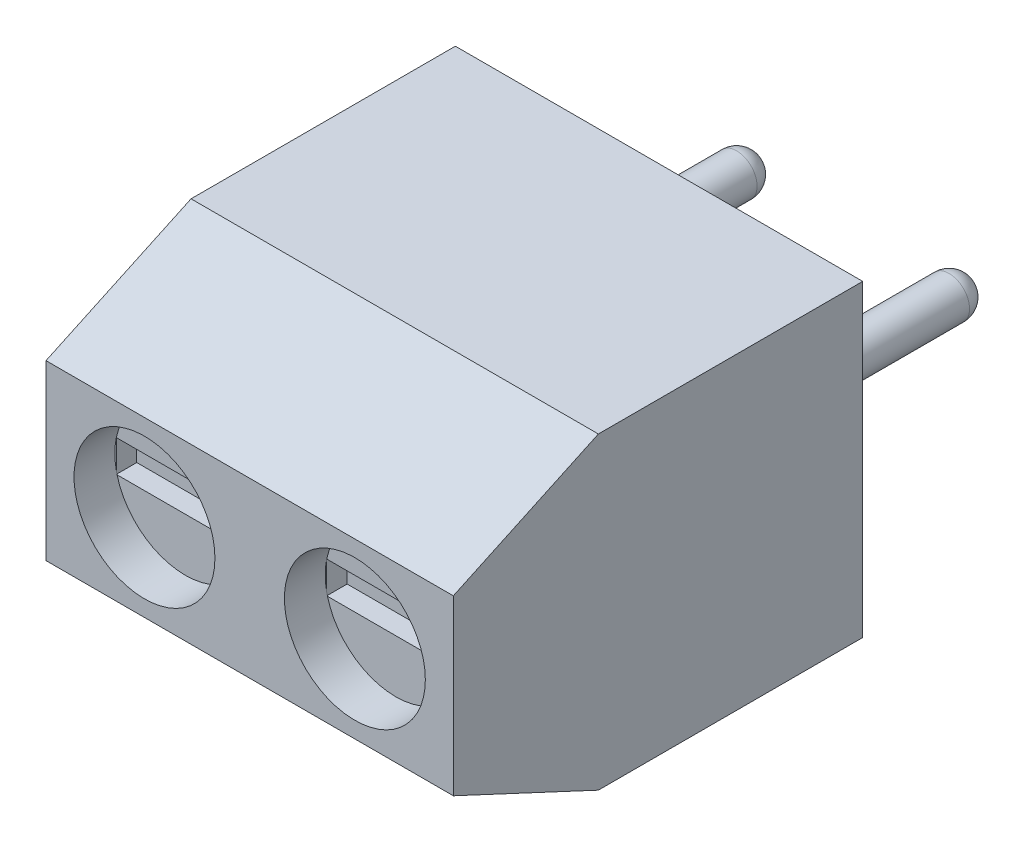
from build123d import *
from OCP.BRepFilletAPI import BRepFilletAPI_MakeChamfer

# Parameters (mm, degrees)
ESQUISSE1_W             = 9.97
ESQUISSE1_H             = 7.55
EXTRUSION1_DEPTH        = 10.02
CHANFREIN1_SIZE         = 3.55
CHANFREIN1_SIZE2        = 1.655392186
ESQUISSE2_R             = 1.725
ENL_V_MAT_EXTRU_1_DEPTH = 1
ESQUISSE3_W             = 4
ESQUISSE3_H             = 5
ENL_V_MAT_EXTRU_2_DEPTH = 1.6
ESQUISSE4_R             = 1.675
ENL_V_MAT_EXTRU_3_DEPTH = 1.6
ESQUISSE5_R             = 0.5
EXTRUSION2_DEPTH        = 5
CONG_1_R                = 0.5
ESQUISSE7_W             = 3.359641585
ESQUISSE7_H             = 0.780050821
ENL_V_MAT_EXTRU_4_DEPTH = 0.5
ESQUISSE8_W             = 3.1960084
ESQUISSE8_H             = 1.003036954
ENL_V_MAT_EXTRU_5_DEPTH = 0.5


with BuildPart() as part:
    # Esquisse1 → Extrusion1 (new body)
    with BuildSketch(Plane.XY):
        with Locations((4.985, 3.775)):
            Rectangle(ESQUISSE1_W, ESQUISSE1_H)
    extrude(amount=EXTRUSION1_DEPTH)

    # Chanfrein1: one chamfer whose edges measure the first distance from different faces: ONE call of the kernel's chamfer builder (chamfer() names one face for all edges)
    chanfrein1_edges_1 = [part.edges().sort_by_distance(p)[0] for p in [
        (4.985, 7.55, 10.02),
    ]]
    chanfrein1_side_1 = [part.faces().sort_by_distance(p)[0] for p in [
        (4.985, 7.55, 5.01),
    ]]
    chanfrein1_edges_2 = [part.edges().sort_by_distance(p)[0] for p in [
        (4.985, 0, 10.02),
    ]]
    chanfrein1_side_2 = [part.faces().sort_by_distance(p)[0] for p in [
        (4.985, 0, 5.01),
    ]]
    chanfrein1 = BRepFilletAPI_MakeChamfer(part.part.solid().wrapped)
    for e in chanfrein1_edges_1:
        chanfrein1.Add(CHANFREIN1_SIZE, CHANFREIN1_SIZE2, e.wrapped, chanfrein1_side_1[0].wrapped)  # the first distance lies on this face
    for e in chanfrein1_edges_2:
        chanfrein1.Add(CHANFREIN1_SIZE, CHANFREIN1_SIZE2, e.wrapped, chanfrein1_side_2[0].wrapped)  # the first distance lies on this face
    add(Compound.cast(chanfrein1.Shape()), mode=Mode.REPLACE)

    # Esquisse2 → Enlèv. mat.-Extru.1 (cut)
    with BuildSketch(Plane.XY.offset(10.02)):
        with Locations((2.410120412, 3.775)):
            Circle(ESQUISSE2_R)
        with Locations((7.559879588, 3.775)):
            Circle(ESQUISSE2_R)
    extrude(amount=-ENL_V_MAT_EXTRU_1_DEPTH, mode=Mode.SUBTRACT)

    # Esquisse3 → Enlèv. mat.-Extru.2 (cut)
    with BuildSketch(Plane.XZ):
        with Locations((7.435, 3.3)):
            Rectangle(ESQUISSE3_W, ESQUISSE3_H)
        with Locations((2.535, 3.3)):
            Rectangle(ESQUISSE3_W, ESQUISSE3_H)
    extrude(amount=-ENL_V_MAT_EXTRU_2_DEPTH, mode=Mode.SUBTRACT)

    # Esquisse4 → Enlèv. mat.-Extru.3 (cut)
    with BuildSketch(Plane.XZ.offset(-1.6)):
        with Locations(Location((7.435, 3.235, 0), (0, 0, 270))):
            Circle(ESQUISSE4_R)
        with Locations(Location((2.535, 3.235, 0), (0, 0, 270))):
            Circle(ESQUISSE4_R)
    extrude(amount=-ENL_V_MAT_EXTRU_3_DEPTH, mode=Mode.SUBTRACT)

    # Esquisse5 → Extrusion2 (add)
    with BuildSketch(Plane(origin=(0, 0, 0), x_dir=(-1, 0, 0), z_dir=(0, 0, -1))):
        with Locations((-7.585, 3.775)):
            Circle(ESQUISSE5_R)
        with Locations((-2.385, 3.775)):
            Circle(ESQUISSE5_R)
    extrude(amount=EXTRUSION2_DEPTH)

    # Congé1
    cong_1_edges = [part.edges().sort_by_distance(p)[0] for p in [
        (8.085, 3.775, -5),
        (2.885, 3.775, -5),
    ]]
    fillet(cong_1_edges, radius=CONG_1_R)

    # Esquisse7 → Enlèv. mat.-Extru.4 (cut)
    with BuildSketch(Plane.XY.offset(9.02)):
        with Locations((2.40077537, 3.734751354)):
            Rectangle(ESQUISSE7_W, ESQUISSE7_H)
        with Locations((7.550534547, 3.734751354)):
            Rectangle(ESQUISSE7_W, ESQUISSE7_H)
    extrude(amount=-ENL_V_MAT_EXTRU_4_DEPTH, mode=Mode.SUBTRACT)

    # Esquisse8 → Enlèv. mat.-Extru.5 (cut)
    with BuildSketch(Plane.XZ.offset(-3.2)):
        with Locations((2.54160667, 3.256051041)):
            Rectangle(ESQUISSE8_W, ESQUISSE8_H)
        with Locations((7.44160667, 3.256051041)):
            Rectangle(ESQUISSE8_W, ESQUISSE8_H)
    extrude(amount=-ENL_V_MAT_EXTRU_5_DEPTH, mode=Mode.SUBTRACT)


solid = part.part
